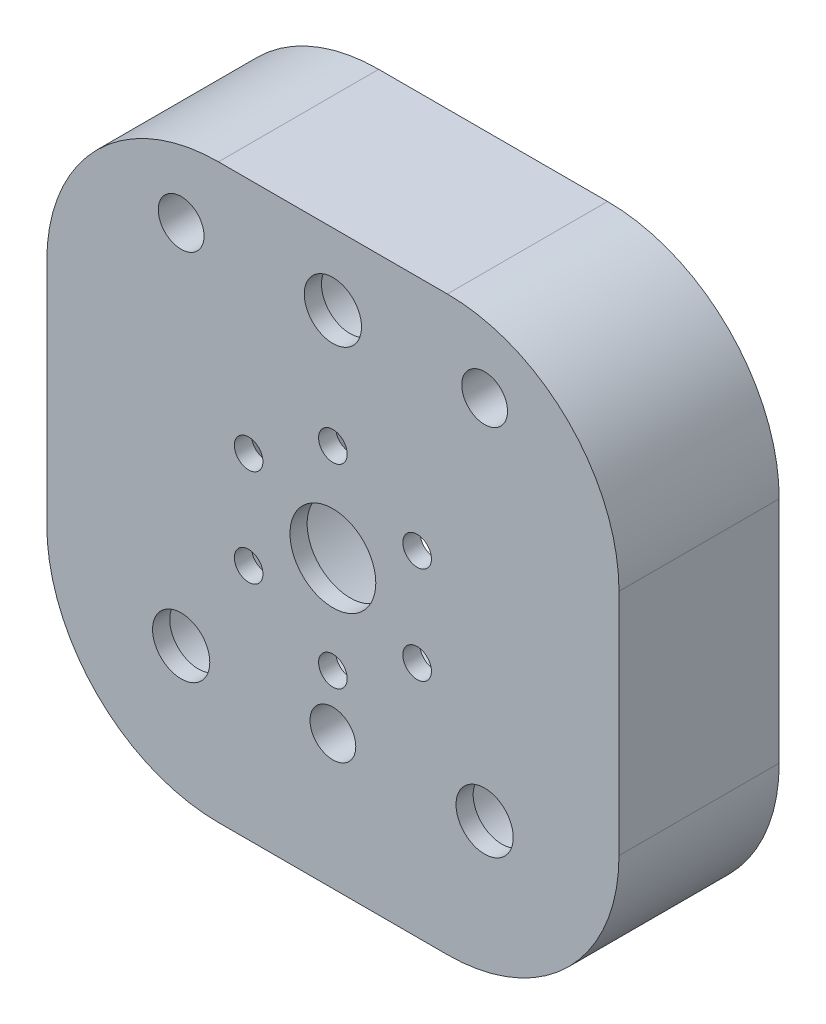
from build123d import *

# Parameters (mm, degrees)
SKETCH1_W           = 100
SKETCH1_H           = 100
SKETCH1_R           = 2.5
SKETCH1_R_2         = 7.5
SKETCH1_R_3         = 5
BOSS_EXTRUDE1_DEPTH = 3
SKETCH2_W           = 100
SKETCH2_H           = 100
SKETCH2_R           = 8.1
SKETCH2_R_2         = 22
BOSS_EXTRUDE2_DEPTH = 25
FILLET2_R           = 3
FILLET3_R           = 3
SKETCH3_R           = 4
CUT_EXTRUDE1_DEPTH  = 25
FILLET4_R           = 30


with BuildPart() as part:
    # Sketch1 → Boss-Extrude1 (new body)
    with BuildSketch(Plane.XY):
        Rectangle(SKETCH1_W, SKETCH1_H)
        with Locations((-14.722431864, 8.5)):
            Circle(SKETCH1_R, mode=Mode.SUBTRACT)
        with Locations((-14.722431864, -8.5)):
            Circle(SKETCH1_R, mode=Mode.SUBTRACT)
        with Locations((0, -17)):
            Circle(SKETCH1_R, mode=Mode.SUBTRACT)
        with Locations((14.722431864, -8.5)):
            Circle(SKETCH1_R, mode=Mode.SUBTRACT)
        with Locations((14.722431864, 8.5)):
            Circle(SKETCH1_R, mode=Mode.SUBTRACT)
        with Locations((0, 17)):
            Circle(SKETCH1_R, mode=Mode.SUBTRACT)
        Circle(SKETCH1_R_2, mode=Mode.SUBTRACT)
        with Locations((0, 37.5)):
            Circle(SKETCH1_R_3, mode=Mode.SUBTRACT)
        with Locations((-26.516504294, -26.516504295)):
            Circle(SKETCH1_R_3, mode=Mode.SUBTRACT)
        with Locations((26.516504294, -26.516504295)):
            Circle(SKETCH1_R_3, mode=Mode.SUBTRACT)
    extrude(amount=BOSS_EXTRUDE1_DEPTH)

    # Sketch2 → Boss-Extrude2 (add)
    with BuildSketch(Plane(origin=(0, 0, 0), x_dir=(-1, 0, 0), z_dir=(0, 0, -1))):
        Rectangle(SKETCH2_W, SKETCH2_H)
        with Locations(Location((-26.516504294, -26.516504294, 0), (0, 0, 180))):
            Circle(SKETCH2_R, mode=Mode.SUBTRACT)
        with Locations(Location((26.516504294, -26.516504294, 0), (0, 0, 180))):
            Circle(SKETCH2_R, mode=Mode.SUBTRACT)
        with Locations(Location((0, 37.5, 0), (0, 0, 180))):
            Circle(SKETCH2_R, mode=Mode.SUBTRACT)
        with Locations(Location((0, 0, 0), (0, 0, 180))):
            Circle(SKETCH2_R_2, mode=Mode.SUBTRACT)
    extrude(amount=BOSS_EXTRUDE2_DEPTH)

    # Fillet2
    fillet2_edges = [part.edges().sort_by_distance(p)[0] for p in [
        (-8.1, 37.5, -25),
        (-34.616504294, -26.516504294, -25),
        (18.416504295, -26.516504294, -25),
    ]]
    fillet(fillet2_edges, radius=FILLET2_R)

    # Fillet3
    fillet3_edges = [part.edges().sort_by_distance(p)[0] for p in [
        (-22, 0, -25),
    ]]
    fillet(fillet3_edges, radius=FILLET3_R)

    # Sketch3 → Cut-Extrude1 (cut)
    with BuildSketch(Plane.XY.offset(3)):
        with Locations((26.516504294, 37.5)):
            Circle(SKETCH3_R)
        with Locations((-26.516504294, 37.5)):
            Circle(SKETCH3_R)
        with Locations((0, -26.516504294)):
            Circle(SKETCH3_R)
    extrude(amount=-CUT_EXTRUDE1_DEPTH, mode=Mode.SUBTRACT)

    # Fillet4
    fillet4_edges = [part.edges().sort_by_distance(p)[0] for p in [
        (-50, 50, -11),
        (50, 50, -11),
        (50, -50, -11),
        (-50, -50, -11),
    ]]
    fillet(fillet4_edges, radius=FILLET4_R)


solid = part.part
